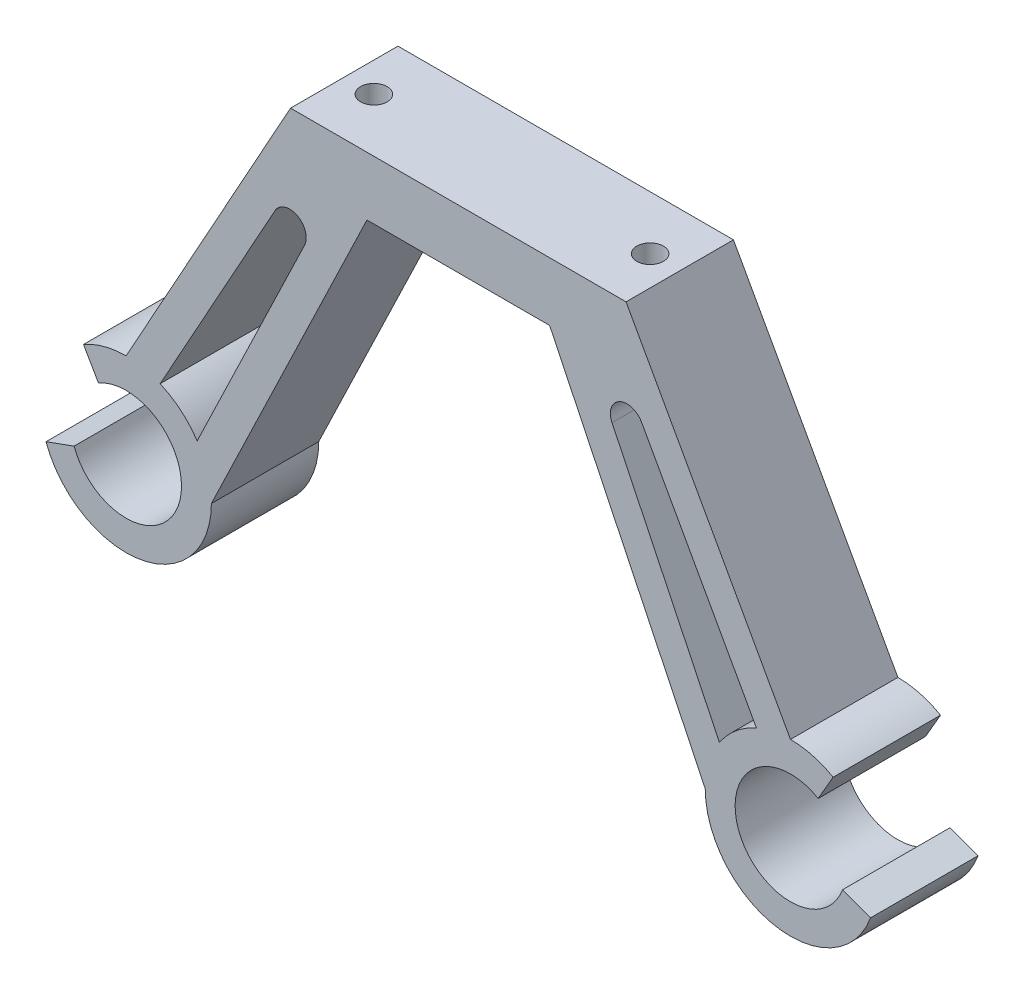
from build123d import *

# Parameters (mm, degrees)
BOSS_EXTRUDE1_DEPTH     = 4.85
CUT_EXTRUDE1_DEPTH      = 44.672701752
CUT_EXTRUDE1_DEPTH_BACK = 44.672701752
SKETCH3_R               = 1.2
CUT_EXTRUDE2_DEPTH      = 4


with BuildPart() as part:
    # Sketch1 → Boss-Extrude1 (new, symmetric)
    with BuildSketch(Plane.XY):
        with BuildLine():
            Line((-15.15, 19.9), (15.15, 19.9))
            Line((15.15, 19.9), (30, -6.9))
            ThreePointArc((30, -6.9), (31.992906647, -7.162371138), (33.85, -7.931604391))
            Line((33.85, -7.931604391), (32.5, -10.269872981))
            ThreePointArc((32.5, -10.269872981), (25.301536896, -16.310100717), (34.698463104, -16.310100717))
            Line((34.698463104, -16.310100717), (37.23563318, -17.233555104))
            ThreePointArc((37.23563318, -17.233555104), (28.662909032, -22.183019698), (22.3, -14.6))
            Line((22.3, -14.6), (8.25, 14.6))
            Line((8.25, 14.6), (-8.25, 14.6))
            Line((-8.25, 14.6), (-22.3, -14.6))
            ThreePointArc((-22.3, -14.6), (-28.662909032, -22.183019698), (-37.23563318, -17.233555104))
            Line((-37.23563318, -17.233555104), (-34.698463104, -16.310100717))
            ThreePointArc((-34.698463104, -16.310100717), (-25.301536896, -16.310100717), (-32.5, -10.269872981))
            Line((-32.5, -10.269872981), (-33.85, -7.931604391))
            ThreePointArc((-33.85, -7.931604391), (-31.992906647, -7.162371138), (-30, -6.9))
            Line((-30, -6.9), (-15.15, 19.9))
        make_face()
    extrude(amount=BOSS_EXTRUDE1_DEPTH, both=True)

    # Sketch2 → Cut-Extrude1 (cut, two sides: drawn at the far end of the back side and taken through both)
    with BuildSketch(Plane.XY.offset(-CUT_EXTRUDE1_DEPTH_BACK)):
        with BuildLine():
            Line((-26.925180599, -7.540574694), (-16.546196528, 11.190521138))
            ThreePointArc((-16.546196528, 11.190521138), (-14.545175942, 11.795919776), (-13.88248318, 9.813136581))
            Line((-13.88248318, 9.813136581), (-23.582107554, -10.345513363))
            ThreePointArc((-23.582107554, -10.345513363), (-25.050776345, -8.701255624), (-26.925180599, -7.540574694))
        make_face()
        with BuildLine():
            Line((13.88248318, 9.813136581), (23.582107554, -10.345513363))
            ThreePointArc((23.582107554, -10.345513363), (25.050776345, -8.701255624), (26.925180599, -7.540574694))
            Line((26.925180599, -7.540574694), (16.546196528, 11.190521138))
            ThreePointArc((16.546196528, 11.190521138), (14.545175942, 11.795919776), (13.88248318, 9.813136581))
        make_face()
    extrude(amount=CUT_EXTRUDE1_DEPTH + CUT_EXTRUDE1_DEPTH_BACK, mode=Mode.SUBTRACT)

    # Sketch3 → Cut-Extrude2 (cut)
    with BuildSketch(Plane(origin=(0, 19.9, 0), x_dir=(1, 0, 0), z_dir=(0, 1, 0))):
        with Locations(Location((-12.475, 0, 0), (0, 0, 270))):
            Circle(SKETCH3_R)
        with Locations(Location((12.475, 0, 0), (0, 0, 270))):
            Circle(SKETCH3_R)
    extrude(amount=-CUT_EXTRUDE2_DEPTH, mode=Mode.SUBTRACT)


solid = part.part
